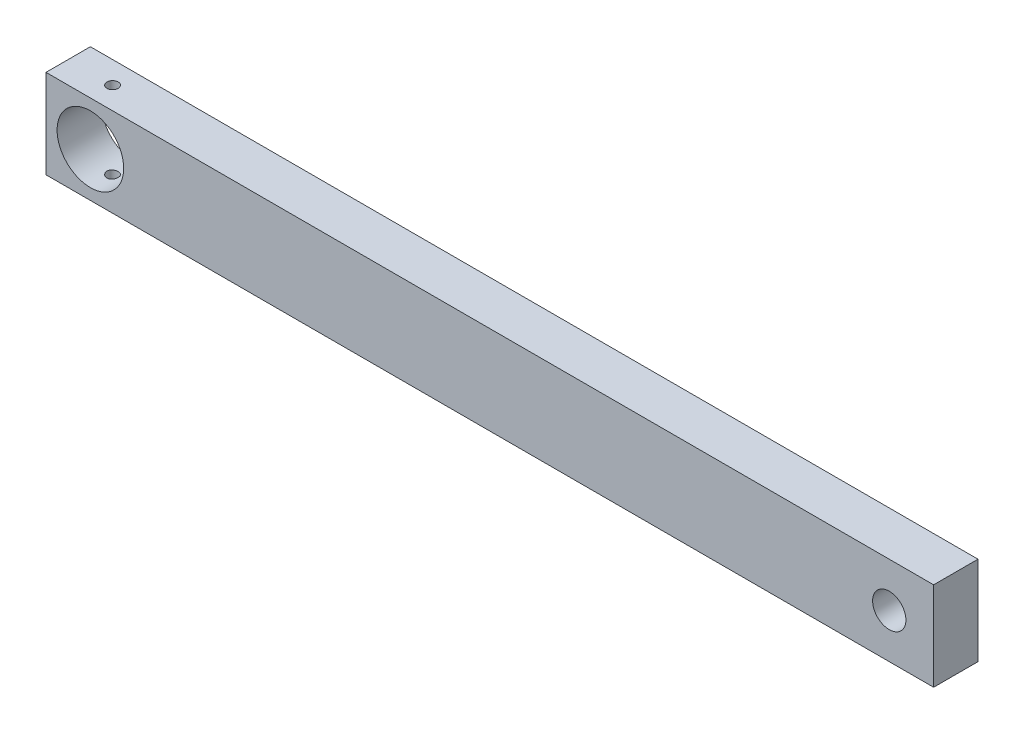
from build123d import *

# Parameters (mm, degrees)
SKETCH1_W           = 127
SKETCH1_H           = 12.7
SKETCH1_R           = 4.7625
SKETCH1_R_2         = 2.38125
BOSS_EXTRUDE1_DEPTH = 6.35
SKETCH2_R           = 0.8001
CUT_EXTRUDE1_DEPTH  = 12.7


with BuildPart() as part:
    # Sketch1 → Boss-Extrude1 (new body)
    with BuildSketch(Plane.XY):
        with Locations((63.5, 6.35)):
            Rectangle(SKETCH1_W, SKETCH1_H)
        with Locations((6.35, 6.35)):
            Circle(SKETCH1_R, mode=Mode.SUBTRACT)
        with Locations((120.65, 6.35)):
            Circle(SKETCH1_R_2, mode=Mode.SUBTRACT)
    extrude(amount=BOSS_EXTRUDE1_DEPTH)

    # Sketch2 → Cut-Extrude1 (cut)
    with BuildSketch(Plane(origin=(0, 12.7, 0), x_dir=(1, 0, 0), z_dir=(0, 1, 0))):
        with Locations(Location((6.35, -3.175, 0), (0, 0, 270))):
            Circle(SKETCH2_R)
    extrude(amount=-CUT_EXTRUDE1_DEPTH, mode=Mode.SUBTRACT)


solid = part.part
